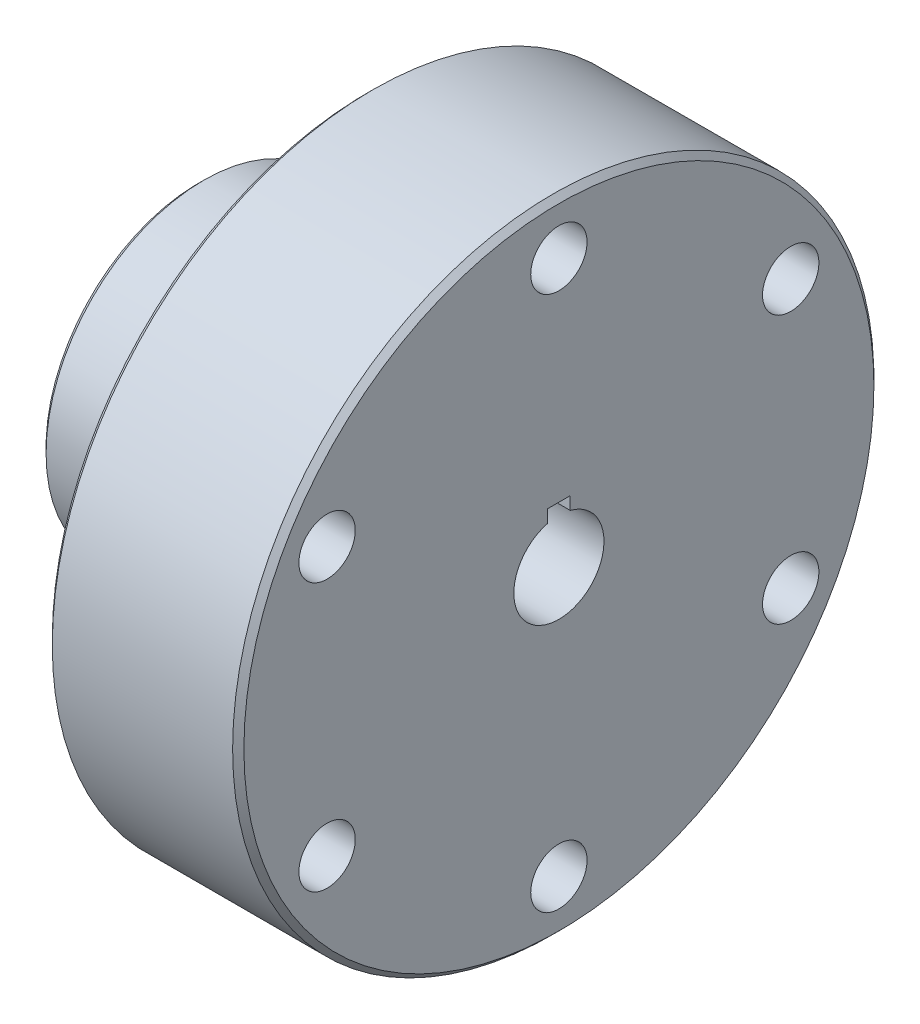
from build123d import *

# Parameters (mm, degrees)
ESQUISSE2_R             = 2.5
ENL_V_MAT_EXTRU_1_DEPTH = 44.678427169
ESQUISSE3_W             = 2
ESQUISSE3_H             = 2.737754662
ENL_V_MAT_EXTRU_2_DEPTH = 52.408219187
ESQUISSE4_R             = 3
ENL_V_MAT_EXTRU_3_DEPTH = 20
CHANFREIN1_SIZE         = 0.5


with BuildPart() as part:
    # Esquisse1 → Révolution1 (revolve)
    with BuildSketch(Plane.XY, mode=Mode.PRIVATE) as r_volution1_sk:
        Polygon((-15, 4), (-15, 14), (-5, 14), (-5, 15), (0, 15), (0, 28.45), (17, 28.45), (17, 4), align=None)
    revolve(r_volution1_sk.sketch.rotate(Axis((-36.38001638, 0, 0), (1, 0, 0)), 90), axis=Axis((-36.38001638, 0, 0), (1, 0, 0)))

    # Esquisse2 → Enlèv. mat.-Extru.1 (cut, through all)
    with BuildSketch(Plane.ZY):
        with Locations((0, 23.75)):
            Circle(ESQUISSE2_R)
        with Locations((20.56810334, 11.875)):
            Circle(ESQUISSE2_R)
        with Locations((20.56810334, -11.875)):
            Circle(ESQUISSE2_R)
        with Locations((0, -23.75)):
            Circle(ESQUISSE2_R)
        with Locations((-20.56810334, -11.875)):
            Circle(ESQUISSE2_R)
        with Locations((-20.56810334, 11.875)):
            Circle(ESQUISSE2_R)
    extrude(amount=-ENL_V_MAT_EXTRU_1_DEPTH, mode=Mode.SUBTRACT)

    # Esquisse3 → Enlèv. mat.-Extru.2 (cut, through all)
    with BuildSketch(Plane.ZY.offset(15)):
        with Locations((0, 3.631122669)):
            Rectangle(ESQUISSE3_W, ESQUISSE3_H)
    extrude(amount=-ENL_V_MAT_EXTRU_2_DEPTH, mode=Mode.SUBTRACT)

    # Esquisse4 → Enlèv. mat.-Extru.3 (cut)
    with BuildSketch(Plane.XY):
        with Locations((-10, 0)):
            Circle(ESQUISSE4_R)
    extrude(amount=-ENL_V_MAT_EXTRU_3_DEPTH, mode=Mode.SUBTRACT)

    # Chanfrein1
    chanfrein1_edges = [part.edges().sort_by_distance(p)[0] for p in [
        (17, 0, -28.45),
        (0, 0, -28.45),
        (-5, 0, -15),
        (-15, 0, -14),
    ]]
    chamfer(chanfrein1_edges, length=CHANFREIN1_SIZE)


solid = part.part
